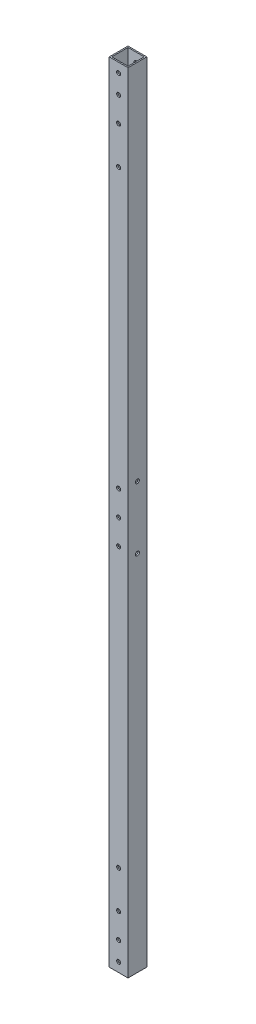
from build123d import *

# Parameters (mm, degrees)
SKETCH_2_W          = 15
SKETCH_2_H          = 15
SKETCH_2_W_2        = 13
SKETCH_2_H_2        = 13
EXTRUDE_1_DEPTH     = 630
SKETCH_3_R          = 1.6
CUT_EXTRUDE_1_DEPTH = 631.223174756
SKETCH_4_R          = 1.6
CUT_EXTRUDE_2_DEPTH = 631.223174756


with BuildPart() as part:
    # 草图2 → 拉伸-薄壁1 (new body)
    with BuildSketch(Plane(origin=(0, 0, 0), x_dir=(1, 0, 0), z_dir=(0, 1, 0))):
        Rectangle(SKETCH_2_W, SKETCH_2_H)
        Rectangle(SKETCH_2_W_2, SKETCH_2_H_2, mode=Mode.SUBTRACT)
    extrude(amount=EXTRUDE_1_DEPTH)

    # 草图3 → 切除-拉伸1 (cut, through all)
    with BuildSketch(Plane.XY.offset(7.5)):
        with Locations((0, 7.5)):
            Circle(SKETCH_3_R)
        with Locations((0, 22.5)):
            Circle(SKETCH_3_R)
        with Locations((0, 42.5)):
            Circle(SKETCH_3_R)
        with Locations((0, 72.5)):
            Circle(SKETCH_3_R)
        with Locations((0, 315)):
            Circle(SKETCH_3_R)
        with Locations((0, 295)):
            Circle(SKETCH_3_R)
        with Locations((0, 335)):
            Circle(SKETCH_3_R)
        with Locations(Location((0, 557.5, 0), (0, 0, 180))):
            Circle(SKETCH_3_R)
        with Locations(Location((0, 587.5, 0), (0, 0, 180))):
            Circle(SKETCH_3_R)
        with Locations(Location((0, 607.5, 0), (0, 0, 180))):
            Circle(SKETCH_3_R)
        with Locations(Location((0, 622.5, 0), (0, 0, 180))):
            Circle(SKETCH_3_R)
    extrude(amount=-CUT_EXTRUDE_1_DEPTH, mode=Mode.SUBTRACT)

    # 草图4 → 切除-拉伸2 (cut, through all)
    with BuildSketch(Plane(origin=(7.5, 0, 0), x_dir=(0, 0, -1), z_dir=(1, 0, 0))):
        with Locations((0, 290)):
            Circle(SKETCH_4_R)
        with Locations((0, 340)):
            Circle(SKETCH_4_R)
    extrude(amount=-CUT_EXTRUDE_2_DEPTH, mode=Mode.SUBTRACT)


solid = part.part
